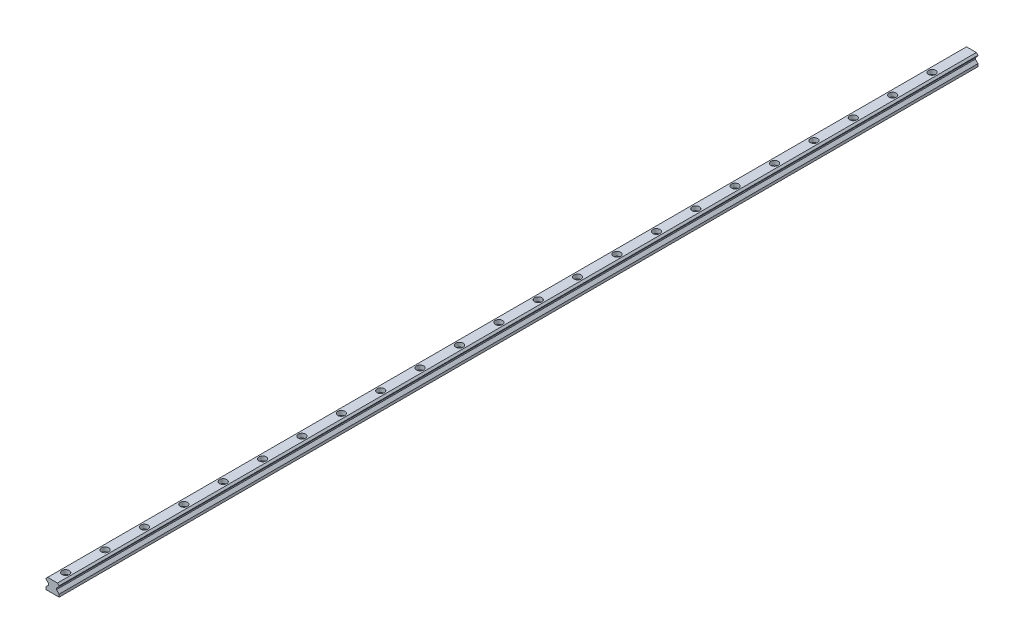
from build123d import *

# Parameters (mm, degrees)
DODANIE_WYCI_GNI_CIE1_DEPTH                         = 1400
POG_BIENIE_WALCOWE_POD_M6_WKR_T_Z_BEM_W_D           = 6.6
POG_BIENIE_WALCOWE_POD_M6_WKR_T_Z_BEM_W_CBORE_D     = 11
POG_BIENIE_WALCOWE_POD_M6_WKR_T_Z_BEM_W_CBORE_DEPTH = 6.4
SZYK_LINIOWY1_COUNT                                 = 23
SZYK_LINIOWY1_PITCH                                 = 60


with BuildPart() as part:
    # Szkic1 → Dodanie-wyciągnięcie1 (new body)
    with BuildSketch(Plane.XY):
        Polygon((10, 0), (-10, 0), (-10, 4), (-6, 8), (-6, 10), (-10, 14), (-10, 15), (-7.5, 17.5), (0, 17.5), (7.5, 17.5), (10, 15), (10, 14), (6, 10), (6, 8), (10, 4), align=None)
    extrude(amount=DODANIE_WYCI_GNI_CIE1_DEPTH)

    # Pogłębienie walcowe pod M6 Wkręt z łbem walcowym z gniazdem sześciokątnym1 (through all)
    with Locations(Plane(origin=(0, 17.5, 0), x_dir=(1, 0, 0), z_dir=(0, 1, 0))):
        with Locations((0, -1380)):
            pog_bienie_walcowe_pod_m6_wkr_t_z_bem_w = CounterBoreHole(POG_BIENIE_WALCOWE_POD_M6_WKR_T_Z_BEM_W_D / 2, POG_BIENIE_WALCOWE_POD_M6_WKR_T_Z_BEM_W_CBORE_D / 2, POG_BIENIE_WALCOWE_POD_M6_WKR_T_Z_BEM_W_CBORE_DEPTH)

    # Szyk liniowy1: Pogłębienie walcowe pod M6 Wkręt z łbem walcowym z gniazdem sześciokątnym1 ×23
    with Locations(*[(0, 0, -i * SZYK_LINIOWY1_PITCH) for i in range(1, SZYK_LINIOWY1_COUNT)]):
        add(pog_bienie_walcowe_pod_m6_wkr_t_z_bem_w, mode=Mode.SUBTRACT)


solid = part.part
